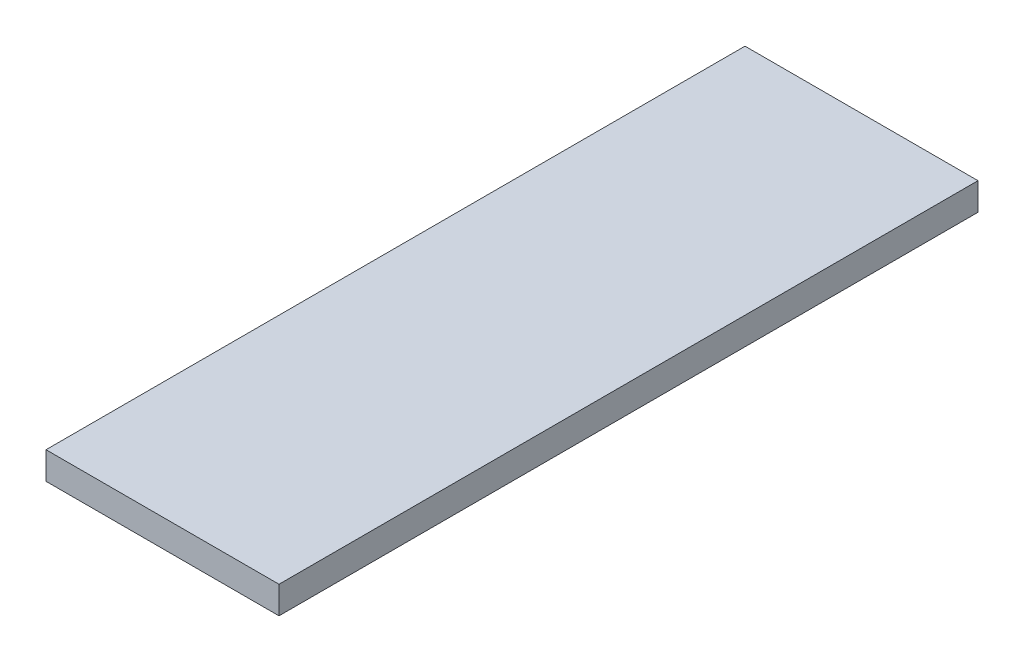
from build123d import *

# Parameters (mm, degrees)
SKETCH1_W  = 101.6
SKETCH1_H  = 11.938
BASE_DEPTH = 304.8


with BuildPart() as part:
    # Sketch1 → base (new body)
    with BuildSketch(Plane.XY):
        with Locations((50.8, 5.969)):
            Rectangle(SKETCH1_W, SKETCH1_H)
    extrude(amount=BASE_DEPTH)


solid = part.part
